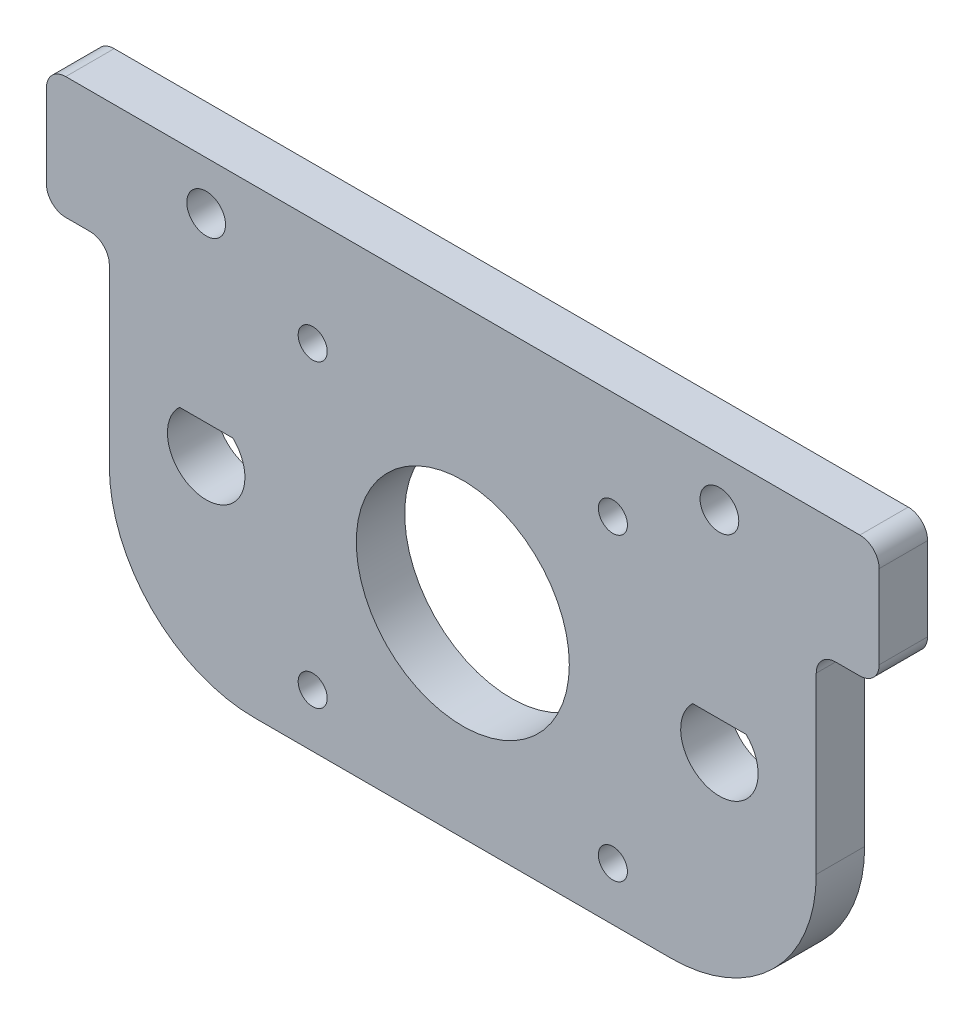
from build123d import *

# Parameters (mm, degrees)
SKETCH1_R           = 2
SKETCH1_R_2         = 11
SKETCH1_R_3         = 1.5
BOSS_EXTRUDE1_DEPTH = 5
FILLET1_R           = 2
FILLET2_R           = 15


with BuildPart() as part:
    # Sketch1 → Boss-Extrude1 (new body)
    with BuildSketch(Plane.XY):
        Polygon((0, 0), (6.5, 0), (6.5, -35), (79.5, -35), (79.5, 0), (86, 0), (86, 12.6), (0, 12.6), align=None)
        with Locations((69.5, 7.6)):
            Circle(SKETCH1_R, mode=Mode.SUBTRACT)
        with Locations((16.5, 7.6)):
            Circle(SKETCH1_R, mode=Mode.SUBTRACT)
        with Locations((43, -14)):
            Circle(SKETCH1_R_2, mode=Mode.SUBTRACT)
        with Locations((27.5, -29.5)):
            Circle(SKETCH1_R_3, mode=Mode.SUBTRACT)
        with Locations((58.5, -29.5)):
            Circle(SKETCH1_R_3, mode=Mode.SUBTRACT)
        with Locations((27.5, 1.5)):
            Circle(SKETCH1_R_3, mode=Mode.SUBTRACT)
        with Locations((58.5, 1.5)):
            Circle(SKETCH1_R_3, mode=Mode.SUBTRACT)
        with BuildLine():
            Line((13.745004537, -11.1), (19.254995463, -11.1))
            ThreePointArc((19.254995463, -11.1), (16.5, -18), (13.745004537, -11.1))
        make_face(mode=Mode.SUBTRACT)
        with BuildLine():
            Line((66.745004537, -11.1), (72.254995463, -11.1))
            ThreePointArc((72.254995463, -11.1), (69.5, -18), (66.745004537, -11.1))
        make_face(mode=Mode.SUBTRACT)
    extrude(amount=BOSS_EXTRUDE1_DEPTH)

    # Fillet1
    fillet1_edges = [part.edges().sort_by_distance(p)[0] for p in [
        (0, 12.6, 2.5),
        (86, 12.6, 2.5),
        (86, 0, 2.5),
        (79.5, 0, 2.5),
        (6.5, 0, 2.5),
        (0, 0, 2.5),
    ]]
    fillet(fillet1_edges, radius=FILLET1_R)

    # Fillet2
    fillet2_edges = [part.edges().sort_by_distance(p)[0] for p in [
        (79.5, -35, 2.5),
        (6.5, -35, 2.5),
    ]]
    fillet(fillet2_edges, radius=FILLET2_R)


solid = part.part
